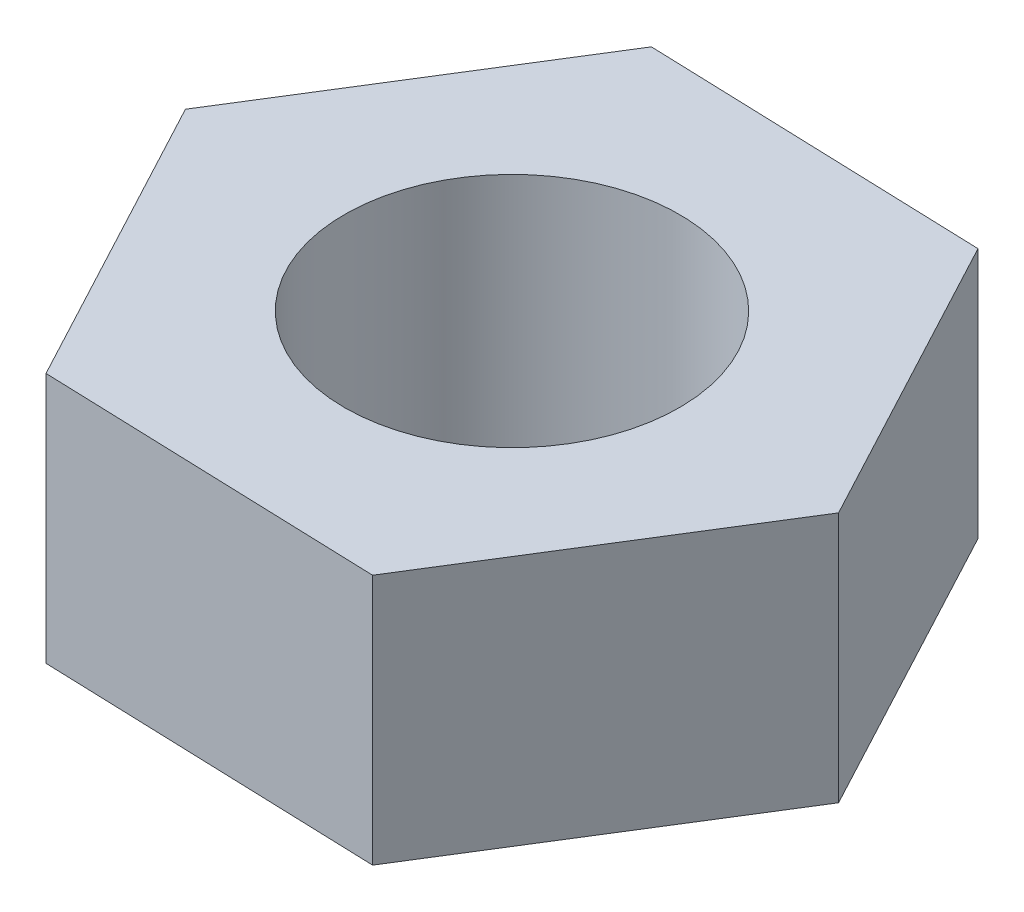
from build123d import *

# Parameters (mm, degrees)
EXTRUDE_1_DEPTH     = 3
SKETCH_2_R          = 3.5
EXTRUDE_2_DEPTH     = 1
SKETCH_4_R          = 2
CUT_EXTRUDE_1_DEPTH = 7.710820383
CUT_EXTRUDE_2_DEPTH = 10


with BuildPart() as part:
    # 草图1 → 凸台-拉伸1 (new body)
    with BuildSketch(Plane(origin=(0, 0, 0), x_dir=(1, 0, 0), z_dir=(0, 1, 0))):
        Polygon((2.138404501, 3.429367219), (-1.90071688, 3.566596231), (-4.039121381, 0.137229012), (-2.138404501, -3.429367219), (1.90071688, -3.566596231), (4.039121381, -0.137229012), align=None)
    extrude(amount=EXTRUDE_1_DEPTH)

    # 草图2 → 凸台-拉伸2 (add)
    with BuildSketch(Plane(origin=(0, 3, 0), x_dir=(1, 0, 0), z_dir=(0, 1, 0))):
        with Locations(Location((0, 0, 0), (0, 0, 88.054126305))):
            Circle(SKETCH_2_R)
    extrude(amount=EXTRUDE_2_DEPTH)

    # 草图4 → 切除-拉伸1 (cut, through all)
    with BuildSketch(Plane(origin=(0, 4, 0), x_dir=(1, 0, 0), z_dir=(0, 1, 0))):
        with Locations(Location((0, 0, 0), (0, 0, 270))):
            Circle(SKETCH_4_R)
    extrude(amount=-CUT_EXTRUDE_1_DEPTH, mode=Mode.SUBTRACT)

    # 草图5 → 切除-拉伸2 (cut)
    with BuildSketch(Plane(origin=(0, 3, 0), x_dir=(1, 0, 0), z_dir=(0, 1, 0))):
        Polygon((1.90071688, -3.566596231), (4.039121381, -0.137229012), (2.138404501, 3.429367219), (-1.90071688, 3.566596231), (-4.039121381, 0.137229012), (-2.138404501, -3.429367219), align=None)
    extrude(amount=CUT_EXTRUDE_2_DEPTH, mode=Mode.SUBTRACT)


solid = part.part
